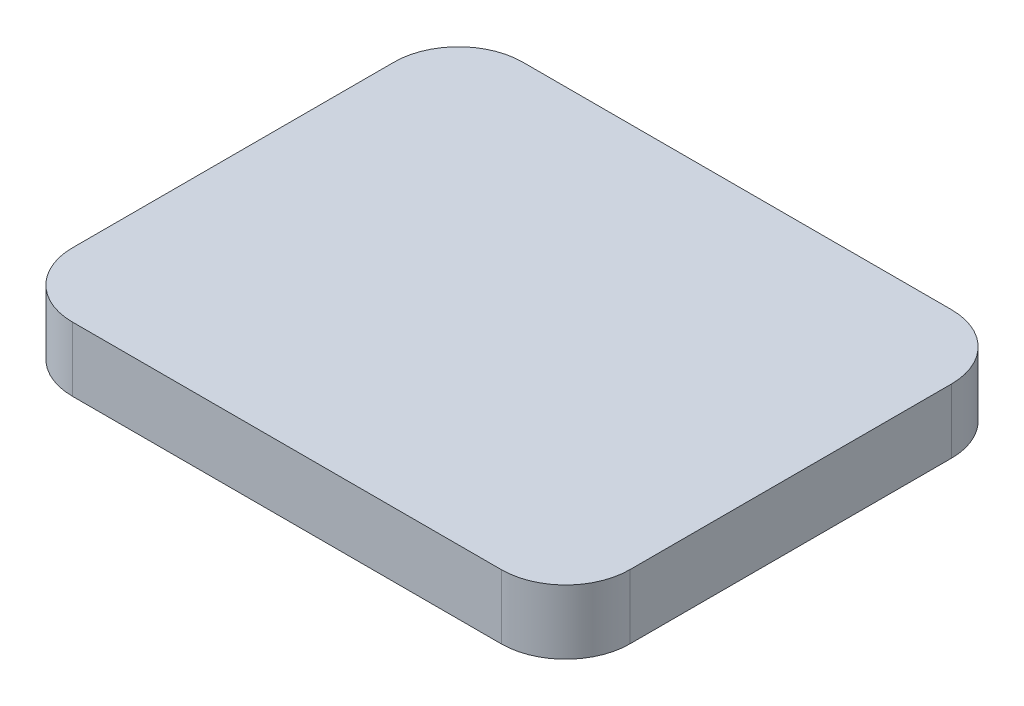
from build123d import *

# Parameters (mm, degrees)
BOSS_EXTRUDE2_DEPTH = 30


with BuildPart() as part:
    # Sketch1 → Boss-Extrude2 (new body)
    with BuildSketch(Plane(origin=(0, 0, 0), x_dir=(1, 0, 0), z_dir=(0, 1, 0))):
        with BuildLine():
            Line((-100, 105), (100, 105))
            ThreePointArc((100, 105), (121.213203436, 96.213203436), (130, 75))
            Line((130, 75), (130, -75))
            ThreePointArc((130, -75), (121.213203436, -96.213203436), (100, -105))
            Line((100, -105), (-100, -105))
            ThreePointArc((-100, -105), (-121.213203436, -96.213203436), (-130, -75))
            Line((-130, -75), (-130, 75))
            ThreePointArc((-130, 75), (-121.213203436, 96.213203436), (-100, 105))
        make_face()
    extrude(amount=BOSS_EXTRUDE2_DEPTH)


solid = part.part
